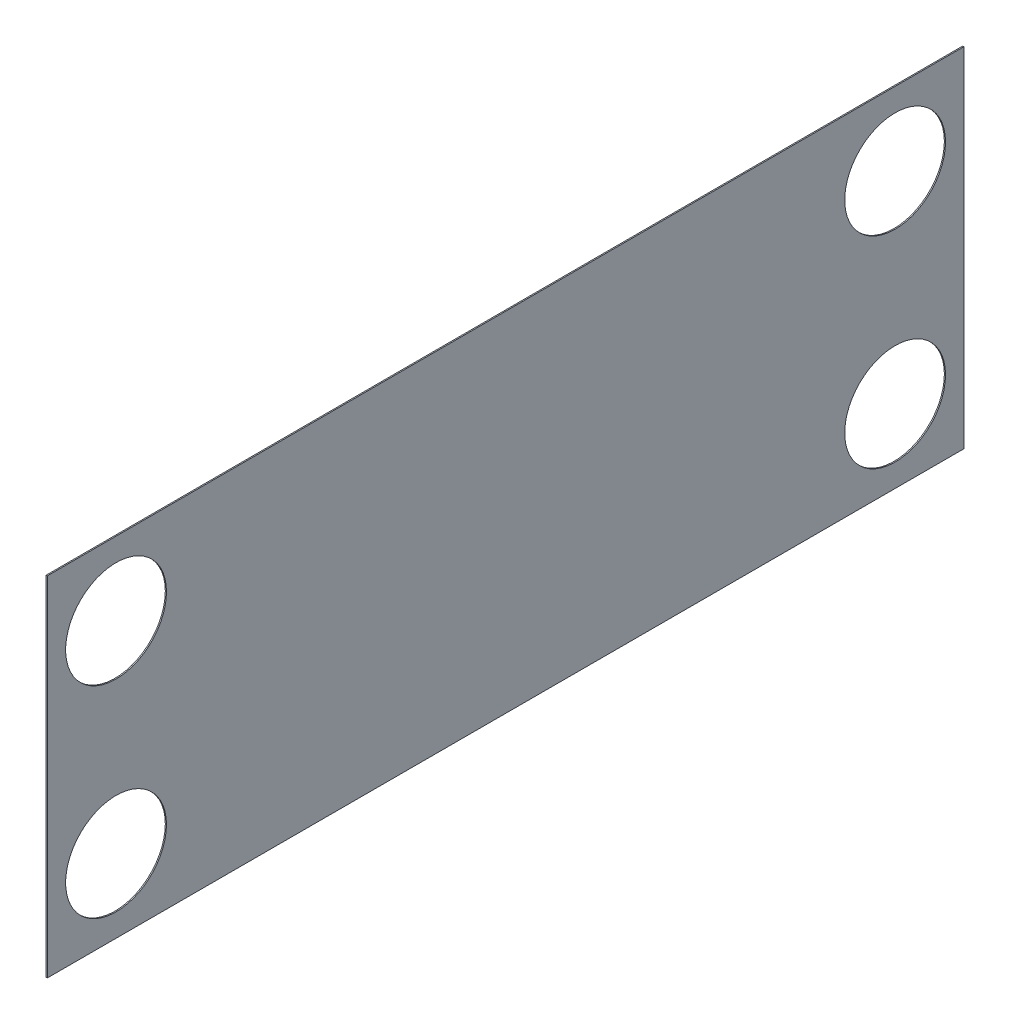
from build123d import *

# Parameters (mm, degrees)
SKETCH1_W             = 100
SKETCH1_H             = 38
BOSS_EXTRUDE1_DEPTH   = 0.127
M10_CLEARANCE_HOLE1_D = 11


with BuildPart() as part:
    # Sketch1 → Boss-Extrude1 (new body)
    with BuildSketch(Plane(origin=(0, 0, 0), x_dir=(0, 0, -1), z_dir=(1, 0, 0))):
        Rectangle(SKETCH1_W, SKETCH1_H)
    extrude(amount=BOSS_EXTRUDE1_DEPTH)

    # M10 Clearance Hole1 (through all)
    with Locations(Plane(origin=(0.127, 0, 0), x_dir=(0, 0, -1), z_dir=(1, 0, 0))):
        with Locations((-42.5, 11), (-42.5, -11), (42.5, 11), (42.5, -11)):
            Hole(M10_CLEARANCE_HOLE1_D / 2)


solid = part.part
